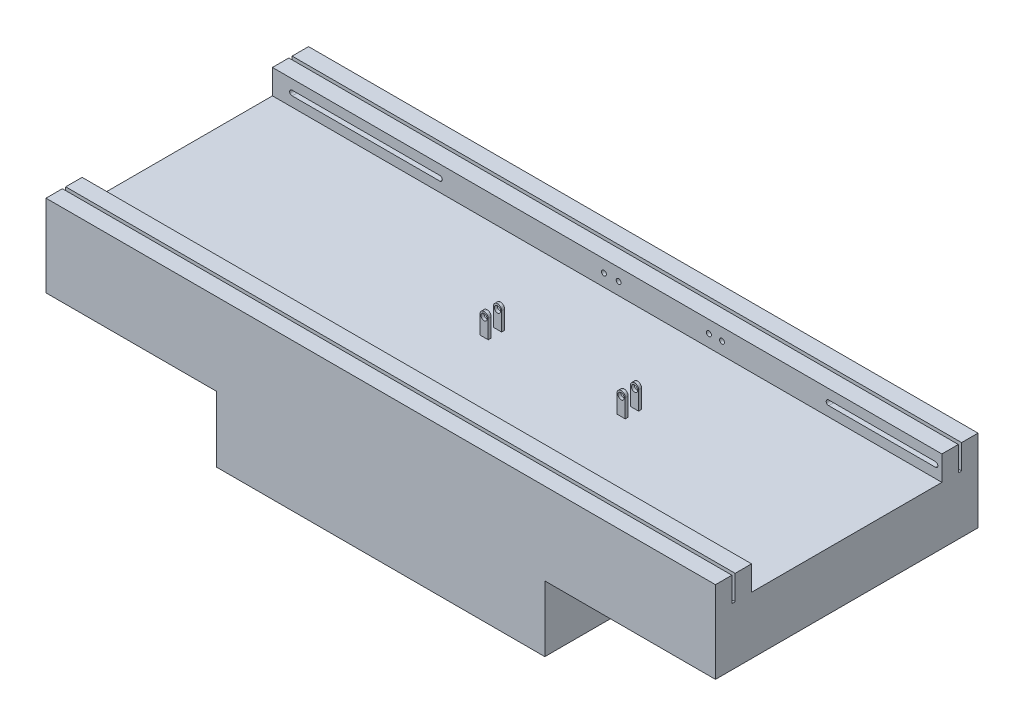
from build123d import *

# Parameters (mm, degrees)
BOSS_EXTRUDE1_DEPTH      = 800
SKETCH2_W                = 300
SKETCH2_H                = 200
CUT_EXTRUDE1_DEPTH       = 125
BOSS_EXTRUDE2_DEPTH      = 100
BOSS_EXTRUDE2_DEPTH_BACK = 100
SKETCH4_R                = 12.5
SKETCH5_W                = 1800
SKETCH5_H                = 700
CUT_EXTRUDE2_DEPTH       = 75
BOSS_EXTRUDE3_DEPTH      = 900
BOSS_EXTRUDE3_DEPTH_BACK = 900
SKETCH8_W                = 50
SKETCH8_H                = 75
BOSS_EXTRUDE4_DEPTH      = 120
BOSS_EXTRUDE5_DEPTH      = 120
CUT_EXTRUDE4_DEPTH       = 740
CUT_EXTRUDE4_DEPTH_BACK  = 40
SKETCH7_R                = 7.5
BOSS_EXTRUDE6_DEPTH      = 25
BOSS_EXTRUDE6_DEPTH_BACK = 25
SKETCH12_R               = 9.525
SKETCH13_W               = 31.75
SKETCH13_H               = 68.5
CUT_EXTRUDE5_DEPTH       = 1381.258967746


with BuildPart() as part:
    # Sketch1 → Boss-Extrude1 (new body)
    with BuildSketch(Plane.XY):
        Polygon((-900, 182.495667244), (900, 182.495667244), (900, -67.504332756), (500, -67.504332756), (500, -267.504332756), (-500, -267.504332756), (-500, -67.504332756), (-900, -67.504332756), align=None)
    extrude(amount=BOSS_EXTRUDE1_DEPTH)

    # Sketch2 → Cut-Extrude1 (cut)
    with BuildSketch(Plane.XZ.offset(67.504332756)):
        with Locations((700, 125)):
            Rectangle(SKETCH2_W, SKETCH2_H)
        with Locations((-700, 125)):
            Rectangle(SKETCH2_W, SKETCH2_H)
        with Locations((-700, 675)):
            Rectangle(SKETCH2_W, SKETCH2_H)
        with Locations((700, 675)):
            Rectangle(SKETCH2_W, SKETCH2_H)
    extrude(amount=-CUT_EXTRUDE1_DEPTH, mode=Mode.SUBTRACT)

    # Sketch4 → Boss-Extrude2 (add, two sides: drawn at the far end of the back side and taken through both)
    # profile 1 of 2: a face of its own
    with BuildSketch(Plane(origin=(0, 0, 400), x_dir=(-1, 0, 0), z_dir=(0, 0, -1)).offset(-BOSS_EXTRUDE2_DEPTH_BACK)):
        with BuildLine():
            Line((-775, -67.504332756), (-625, -67.504332756))
            ThreePointArc((-625, -67.504332756), (-700, -142.504332756), (-775, -67.504332756))
        make_face()
        with Locations((-700, -117.504332756)):
            Circle(SKETCH4_R, mode=Mode.SUBTRACT)
    # profile 2 of 2: a face of its own
    with BuildSketch(Plane(origin=(0, 0, 400), x_dir=(-1, 0, 0), z_dir=(0, 0, -1)).offset(-BOSS_EXTRUDE2_DEPTH_BACK)):
        with BuildLine():
            Line((625, -67.504332756), (775, -67.504332756))
            ThreePointArc((775, -67.504332756), (700, -142.504332756), (625, -67.504332756))
        make_face()
        with Locations(Location((700, -117.504332756, 0), (0, 0, 180))):
            Circle(SKETCH4_R, mode=Mode.SUBTRACT)
    extrude(amount=BOSS_EXTRUDE2_DEPTH + BOSS_EXTRUDE2_DEPTH_BACK)

    # Sketch5 → Cut-Extrude2 (cut)
    with BuildSketch(Plane(origin=(0, 182.495667244, 0), x_dir=(1, 0, 0), z_dir=(0, 1, 0))):
        with Locations((0, -400)):
            Rectangle(SKETCH5_W, SKETCH5_H)
    extrude(amount=-CUT_EXTRUDE2_DEPTH, mode=Mode.SUBTRACT)

    # Sketch8 → Boss-Extrude3 (add, two sides: drawn at the far end of the back side and taken through both)
    with BuildSketch(Plane(origin=(0, 0, 0), x_dir=(0, 0, -1), z_dir=(1, 0, 0)).offset(-BOSS_EXTRUDE3_DEPTH_BACK)):
        with Locations((-715, 144.995667244)):
            Rectangle(SKETCH8_W, SKETCH8_H)
        with Locations((-85, 144.995667244)):
            Rectangle(SKETCH8_W, SKETCH8_H)
    extrude(amount=BOSS_EXTRUDE3_DEPTH + BOSS_EXTRUDE3_DEPTH_BACK)

    # Sketch9 → Boss-Extrude4 (add)
    with BuildSketch(Plane(origin=(900, 0, 0), x_dir=(0, 0, -1), z_dir=(1, 0, 0))):
        Polygon((-800, 182.495667244), (-750, 182.495667244), (-750, 107.495667244), (-740, 107.495667244), (-740, 182.495667244), (-690, 182.495667244), (-690, 107.495667244), (-110, 107.495667244), (-110, 182.495667244), (-60, 182.495667244), (-60, 107.495667244), (-50, 107.495667244), (-50, 182.495667244), (0, 182.495667244), (0, -67.504332756), (-800, -67.504332756), align=None)
    extrude(amount=BOSS_EXTRUDE4_DEPTH)

    # Sketch10 → Boss-Extrude5 (add)
    with BuildSketch(Plane.ZY.offset(900)):
        Polygon((800, 182.495667244), (750, 182.495667244), (750, 107.495667244), (740, 107.495667244), (740, 182.495667244), (690, 182.495667244), (690, 107.495667244), (110, 107.495667244), (110, 182.495667244), (60, 182.495667244), (60, 107.495667244), (50, 107.495667244), (50, 182.495667244), (0, 182.495667244), (0, -67.504332756), (800, -67.504332756), align=None)
    extrude(amount=BOSS_EXTRUDE5_DEPTH)

    # Sketch7 → Cut-Extrude4 (cut, two sides: drawn at the far end of the back side and taken through both)
    with BuildSketch(Plane(origin=(0, 0, 750), x_dir=(-1, 0, 0), z_dir=(0, 0, -1)).offset(-CUT_EXTRUDE4_DEPTH_BACK)):
        with Locations(Location((-35, 144.995667244, 0), (0, 0, 180))):
            Circle(SKETCH7_R)
        with Locations(Location((-350, 144.995667244, 0), (0, 0, 180))):
            Circle(SKETCH7_R)
        with Locations(Location((-310, 144.995667244, 0), (0, 0, 180))):
            Circle(SKETCH7_R)
        with Locations(Location((10, 144.995667244, 0), (0, 0, 180))):
            Circle(SKETCH7_R)
        with BuildLine():
            Line((960, 137.495667244), (510, 137.495667244))
            ThreePointArc((510, 137.495667244), (502.5, 144.995667244), (510, 152.495667244))
            Line((510, 152.495667244), (960, 152.495667244))
            ThreePointArc((960, 152.495667244), (967.5, 144.995667244), (960, 137.495667244))
        make_face()
        with BuildLine():
            Line((-1000, 152.495667244), (-675, 152.495667244))
            ThreePointArc((-675, 152.495667244), (-667.5, 144.995667244), (-675, 137.495667244))
            Line((-675, 137.495667244), (-1000, 137.495667244))
            ThreePointArc((-1000, 137.495667244), (-1007.5, 144.995667244), (-1000, 152.495667244))
        make_face()
    extrude(amount=CUT_EXTRUDE4_DEPTH + CUT_EXTRUDE4_DEPTH_BACK, mode=Mode.SUBTRACT)

    # Sketch12 → Boss-Extrude6 (add, two sides: drawn at the far end of the back side and taken through both)
    # profile 1 of 2: a face of its own
    with BuildSketch(Plane(origin=(0, 0, 400), x_dir=(-1, 0, 0), z_dir=(0, 0, -1)).offset(-BOSS_EXTRUDE6_DEPTH_BACK)):
        with BuildLine():
            Line((72.5, 107.495667244), (72.5, 163.595667244))
            ThreePointArc((72.5, 163.595667244), (68.868124087, 172.363791331), (60.1, 175.995667244))
            Line((60.1, 175.995667244), (59.9, 175.995667244))
            ThreePointArc((59.9, 175.995667244), (51.131875913, 172.363791331), (47.5, 163.595667244))
            Line((47.5, 163.595667244), (47.5, 107.495667244))
            Line((47.5, 107.495667244), (72.5, 107.495667244))
        make_face()
        with Locations((60, 160.995667244)):
            Circle(SKETCH12_R, mode=Mode.SUBTRACT)
    # profile 2 of 2: a face of its own
    with BuildSketch(Plane(origin=(0, 0, 400), x_dir=(-1, 0, 0), z_dir=(0, 0, -1)).offset(-BOSS_EXTRUDE6_DEPTH_BACK)):
        with BuildLine():
            Line((-345, 107.495667244), (-345, 163.595667244))
            ThreePointArc((-345, 163.595667244), (-348.631875913, 172.363791331), (-357.4, 175.995667244))
            Line((-357.4, 175.995667244), (-357.6, 175.995667244))
            ThreePointArc((-357.6, 175.995667244), (-366.368124087, 172.363791331), (-370, 163.595667244))
            Line((-370, 163.595667244), (-370, 107.495667244))
            Line((-370, 107.495667244), (-345, 107.495667244))
        make_face()
        with Locations((-357.5, 160.995667244)):
            Circle(SKETCH12_R, mode=Mode.SUBTRACT)
    extrude(amount=BOSS_EXTRUDE6_DEPTH + BOSS_EXTRUDE6_DEPTH_BACK)

    # Sketch13 → Cut-Extrude5 (cut, through all)
    with BuildSketch(Plane.ZY.offset(72.5)):
        with Locations((400, 141.745667244)):
            Rectangle(SKETCH13_W, SKETCH13_H)
    extrude(amount=-CUT_EXTRUDE5_DEPTH, mode=Mode.SUBTRACT)


solid = part.part
